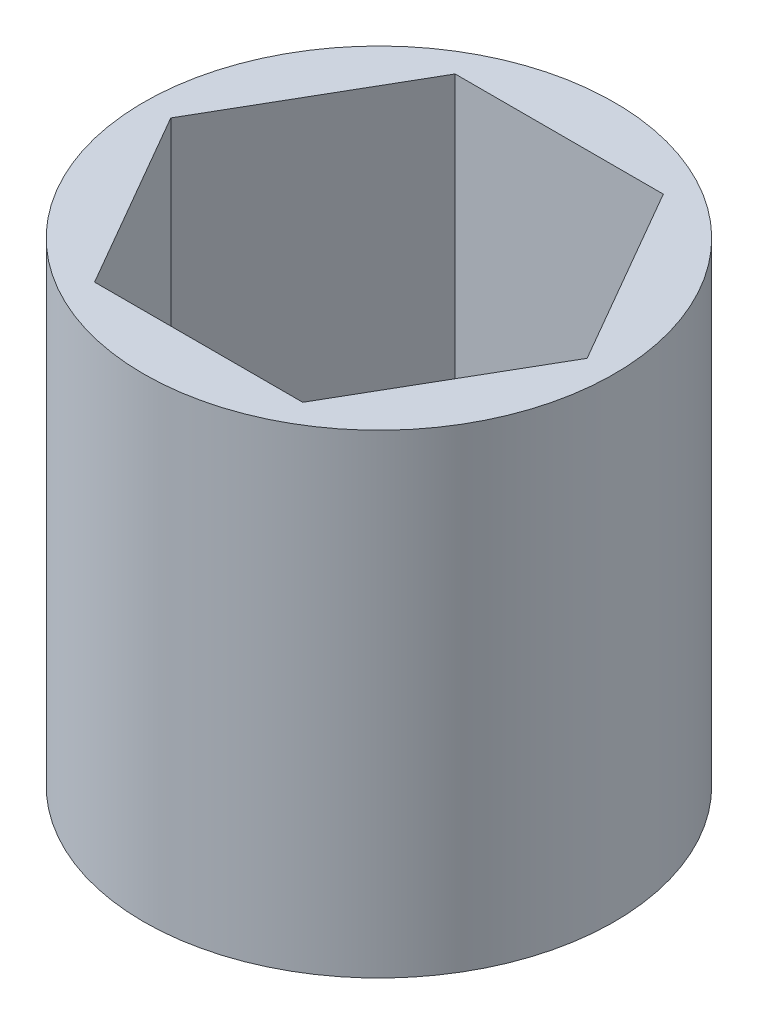
from build123d import *

# Parameters (mm, degrees)
SKETCH1_R           = 6.2992
BOSS_EXTRUDE1_DEPTH = 12.7


with BuildPart() as part:
    # Sketch1 → Boss-Extrude1 (new body)
    with BuildSketch(Plane(origin=(0, 0, 0), x_dir=(1, 0, 0), z_dir=(0, 1, 0))):
        with Locations(Location((0, 0, 0), (0, 0, 270))):
            Circle(SKETCH1_R)
        Polygon((5.572584798, 0), (2.786292399, 4.826), (-2.786292399, 4.826), (-5.572584798, 0), (-2.786292399, -4.826), (2.786292399, -4.826), align=None, mode=Mode.SUBTRACT)
    extrude(amount=BOSS_EXTRUDE1_DEPTH)


solid = part.part
